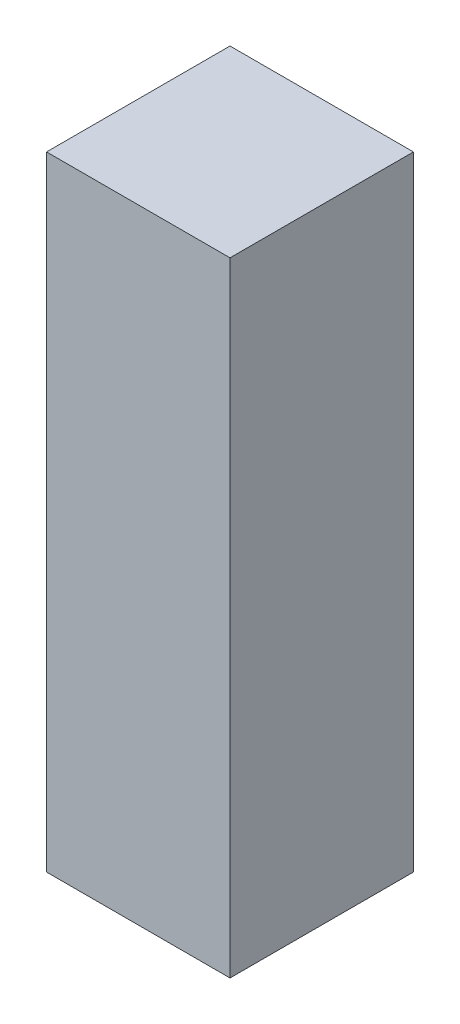
from build123d import *

# Parameters (mm, degrees)
CROQUIS1_W              = 5
CROQUIS1_H              = 5
SALIENTE_EXTRUIR1_DEPTH = 8.5


with BuildPart() as part:
    # Croquis1 → Saliente-Extruir1 (new, symmetric)
    with BuildSketch(Plane(origin=(0, 0, 0), x_dir=(1, 0, 0), z_dir=(0, 1, 0))):
        Rectangle(CROQUIS1_W, CROQUIS1_H)
    extrude(amount=SALIENTE_EXTRUIR1_DEPTH, both=True)


solid = part.part
